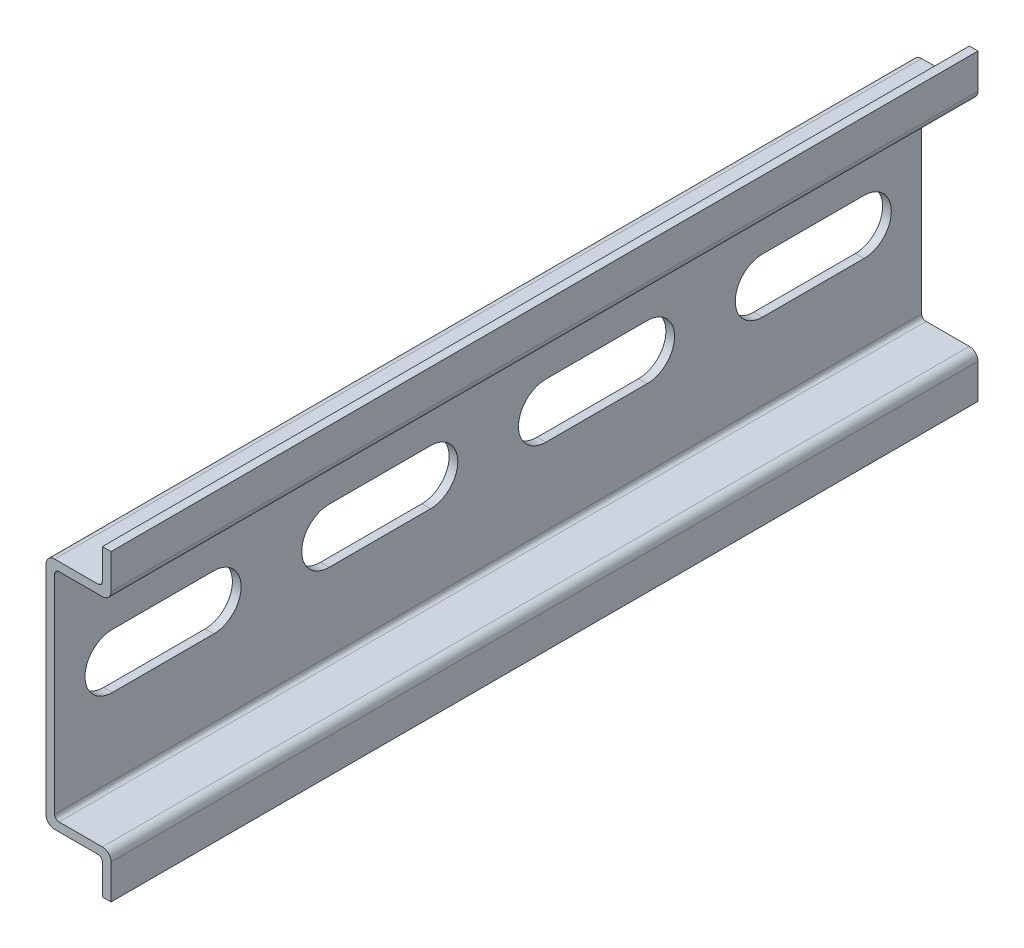
from build123d import *

# Parameters (mm, degrees)
BOSS_EXTRUDE1_DEPTH = 50
CUT_EXTRUDE1_DEPTH  = 7.5
LPATTERN1_COUNT     = 4
LPATTERN1_PITCH     = 25


with BuildPart() as part:
    # Sketch1 → Boss-Extrude1 (new, symmetric)
    with BuildSketch(Plane.XY):
        with BuildLine():
            Line((7.5, 17.5), (6.5, 17.5))
            Line((6.5, 17.5), (6.5, 14))
            ThreePointArc((6.5, 14), (6.353553391, 13.646446609), (6, 13.5))
            Line((6, 13.5), (1, 13.5))
            ThreePointArc((1, 13.5), (0.292893219, 13.207106781), (0, 12.5))
            Line((0, 12.5), (0, -12.5))
            ThreePointArc((0, -12.5), (0.292893219, -13.207106781), (1, -13.5))
            Line((1, -13.5), (6, -13.5))
            ThreePointArc((6, -13.5), (6.353553391, -13.646446609), (6.5, -14))
            Line((6.5, -14), (6.5, -17.5))
            Line((6.5, -17.5), (7.5, -17.5))
            Line((7.5, -17.5), (7.5, -13.5))
            ThreePointArc((7.5, -13.5), (7.207106781, -12.792893219), (6.5, -12.5))
            Line((6.5, -12.5), (1.5, -12.5))
            ThreePointArc((1.5, -12.5), (1.146446609, -12.353553391), (1, -12))
            Line((1, -12), (1, 12))
            ThreePointArc((1, 12), (1.146446609, 12.353553391), (1.5, 12.5))
            Line((1.5, 12.5), (6.5, 12.5))
            ThreePointArc((6.5, 12.5), (7.207106781, 12.792893219), (7.5, 13.5))
            Line((7.5, 13.5), (7.5, 17.5))
        make_face()
    extrude(amount=BOSS_EXTRUDE1_DEPTH, both=True)

    # Sketch2 → Cut-Extrude1 (cut)
    with BuildSketch(Plane(origin=(0, 0, 0), x_dir=(0, 0, -1), z_dir=(1, 0, 0))):
        with BuildLine():
            Line((-43.35, 3.15), (-31.65, 3.15))
            ThreePointArc((-31.65, 3.15), (-28.5, 0), (-31.65, -3.15))
            Line((-31.65, -3.15), (-43.35, -3.15))
            ThreePointArc((-43.35, -3.15), (-46.5, 0), (-43.35, 3.15))
        make_face()
    cut_extrude1 = extrude(amount=CUT_EXTRUDE1_DEPTH, mode=Mode.SUBTRACT)

    # LPattern1: Cut-Extrude1 ×4
    with Locations(*[(0, 0, -i * LPATTERN1_PITCH) for i in range(1, LPATTERN1_COUNT)]):
        add(cut_extrude1, mode=Mode.SUBTRACT)


solid = part.part
